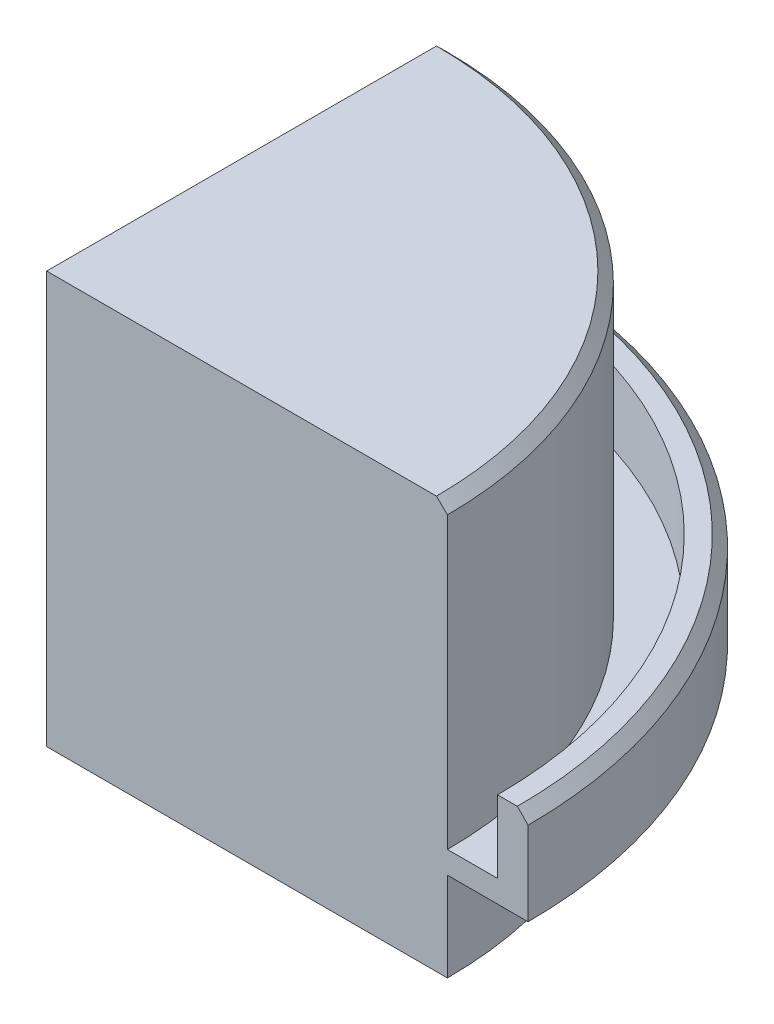
from build123d import *
from OCP.BRepFilletAPI import BRepFilletAPI_MakeChamfer

# Parameters (mm, degrees)
BOSS_EXTRUDE3_DEPTH     = 18.796
CUT_EXTRUDE1_START      = -10.414
CUT_EXTRUDE1_DEPTH      = 10.414
CUT_EXTRUDE_THIN1_DEPTH = 4.064
CUT_EXTRUDE2_START      = -3.302
CUT_EXTRUDE2_DEPTH      = 3.302
CHAMFER1_SIZE           = 0.5
CHAMFER1_SIZE2          = 0.491348578


with BuildPart() as part:
    # Sketch2 → Boss-Extrude3 (new body)
    with BuildSketch(Plane(origin=(0, 0, 0), x_dir=(1, 0, 0), z_dir=(0, 1, 0))):
        with BuildLine():
            Line((0, 0), (0, 21.971))
            ThreePointArc((0, 21.971), (15.535843089, 15.535843089), (21.971, 0))
            Line((21.971, 0), (0, 0))
        make_face()
    extrude(amount=BOSS_EXTRUDE3_DEPTH)

    # Sketch4 → Cut-Extrude1 (cut)
    with BuildSketch(Plane(origin=(0, 18.796, 0), x_dir=(1, 0, 0), z_dir=(0, 1, 0)).offset(CUT_EXTRUDE1_START)):
        with BuildLine():
            Line((18.288, 0), (21.971, 0))
            ThreePointArc((21.971, 0), (15.535843089, 15.535843089), (0, 21.971))
            Line((0, 21.971), (0, 18.288))
            ThreePointArc((0, 18.288), (12.931568814, 12.931568814), (18.288, 0))
        make_face()
    extrude(amount=CUT_EXTRUDE1_DEPTH, mode=Mode.SUBTRACT)

    # Sketch5 → Cut-Extrude-Thin1 (cut)
    with BuildSketch(Plane.XZ):
        with BuildLine():
            ThreePointArc((21.971, 0), (15.535843089, -15.535843089), (0, -21.971))
            Line((0, -21.971), (0, -19.431))
            ThreePointArc((0, -19.431), (13.739791865, -13.739791865), (19.431, 0))
            Line((19.431, 0), (21.971, 0))
        make_face()
        with BuildLine():
            ThreePointArc((0, -18.288), (12.931568814, -12.931568814), (18.288, 0))
            Line((18.288, 0), (20.828, 0))
            ThreePointArc((20.828, 0), (14.727620039, -14.727620039), (0, -20.828))
            Line((0, -20.828), (0, -18.288))
        make_face()
    extrude(amount=-CUT_EXTRUDE_THIN1_DEPTH, mode=Mode.SUBTRACT)

    # Sketch6 → Cut-Extrude2 (cut)
    with BuildSketch(Plane(origin=(0, 8.382, 0), x_dir=(1, 0, 0), z_dir=(0, 1, 0)).offset(CUT_EXTRUDE2_START)):
        with BuildLine():
            Line((0, 18.288), (0, 20.574))
            ThreePointArc((0, 20.574), (14.548014916, 14.548014916), (20.574, 0))
            Line((20.574, 0), (18.288, 0))
            ThreePointArc((18.288, 0), (12.931568814, 12.931568814), (0, 18.288))
        make_face()
    extrude(amount=CUT_EXTRUDE2_DEPTH, mode=Mode.SUBTRACT)

    # Chamfer1: one chamfer whose edges measure the first distance from different faces: ONE call of the kernel's chamfer builder (chamfer() names one face for all edges)
    chamfer1_edges_1 = [part.edges().sort_by_distance(p)[0] for p in [
        (15.535843089, 8.382, -15.535843089),
    ]]
    chamfer1_side_1 = [part.faces().sort_by_distance(p)[0] for p in [
        (15.535843089, 6.223, -15.535843089),
    ]]
    chamfer1_edges_2 = [part.edges().sort_by_distance(p)[0] for p in [
        (12.931568814, 18.796, -12.931568814),
    ]]
    chamfer1_side_2 = [part.faces().sort_by_distance(p)[0] for p in [
        (7.761668265, 18.796, -7.761668265),
    ]]
    chamfer1 = BRepFilletAPI_MakeChamfer(part.part.solid().wrapped)
    for e in chamfer1_edges_1:
        chamfer1.Add(CHAMFER1_SIZE, CHAMFER1_SIZE2, e.wrapped, chamfer1_side_1[0].wrapped)  # the first distance lies on this face
    for e in chamfer1_edges_2:
        chamfer1.Add(CHAMFER1_SIZE, CHAMFER1_SIZE2, e.wrapped, chamfer1_side_2[0].wrapped)  # the first distance lies on this face
    add(Compound.cast(chamfer1.Shape()), mode=Mode.REPLACE)


solid = part.part
